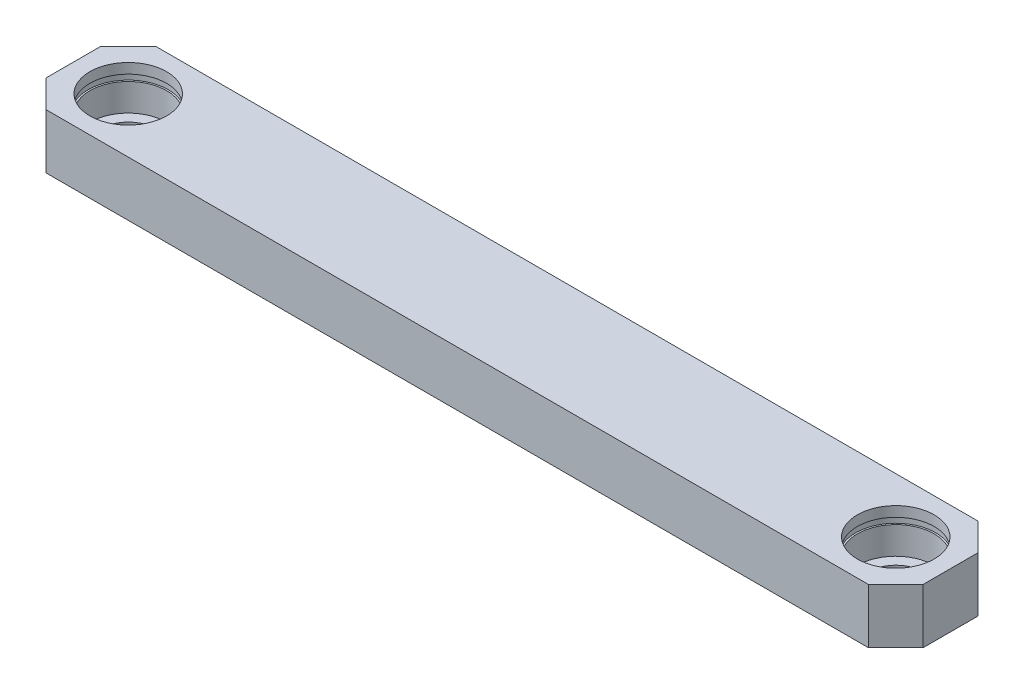
from build123d import *

# Parameters (mm, degrees)
SKETCH1_W           = 160
SKETCH1_H           = 20
BOSS_EXTRUDE1_DEPTH = 10
CHAMFER1_SIZE       = 5


with BuildPart() as part:
    # Sketch1 → Boss-Extrude1 (new body)
    with BuildSketch(Plane(origin=(0, 0, 0), x_dir=(1, 0, 0), z_dir=(0, 1, 0))):
        with Locations((80, 0)):
            Rectangle(SKETCH1_W, SKETCH1_H)
    extrude(amount=BOSS_EXTRUDE1_DEPTH)

    # Chamfer1
    chamfer1_edges = [part.edges().sort_by_distance(p)[0] for p in [
        (0, 5, -10),
        (160, 5, -10),
        (160, 5, 10),
        (0, 5, 10),
    ]]
    chamfer(chamfer1_edges, length=CHAMFER1_SIZE)

    # Sketch2 → Cut-Revolve1 (revolve, cut)
    with BuildSketch(Plane.XY):
        Polygon((2.7, 7), (3, 7), (3, 2), (5, 2), (5, 0), (10, 0), (10, 10), (3, 10), (3, 8.15), (2.7, 8.15), align=None)
    revolve(axis=Axis((10, 10, 0), (0, -1, 0)), mode=Mode.SUBTRACT)

    # Sketch7 → Cut-Revolve2 (revolve, cut)
    with BuildSketch(Plane.XY, mode=Mode.PRIVATE) as cut_revolve2_sk:
        Polygon((143, 10), (143, 8.15), (142.7, 8.15), (142.7, 7), (143, 7), (143, 2), (145, 2), (145, 0), (150, 0), (150, 10), align=None)
    revolve(cut_revolve2_sk.sketch.rotate(Axis((150, 10, 0), (0, -1, 0)), 270), axis=Axis((150, 10, 0), (0, -1, 0)), mode=Mode.SUBTRACT)


solid = part.part
